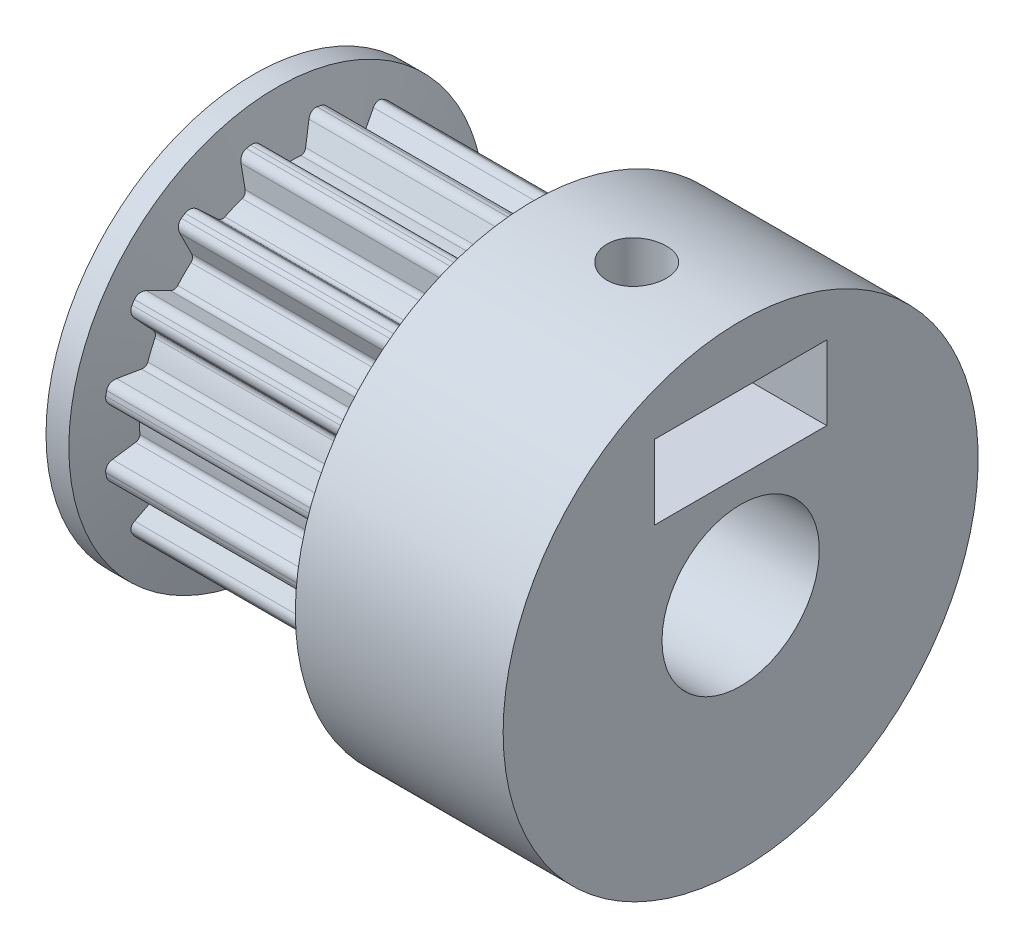
from build123d import *

# Parameters (mm, degrees)
SKETCH2_W          = 9
SKETCH2_H          = 6.1
COG_DEPTH          = 13.466755793
PATTERN_COG_COUNT  = 16
SKETCH3_W          = 7
SKETCH3_H          = 8
SKETCH8_W          = 16
SKETCH8_H          = 2.65
SKETCH15_W         = 1
SKETCH15_H         = 197.35
CUT_EXTRUDE1_DEPTH = 2.5


with BuildPart() as part:
    # Sketch2 → Body (revolve)
    with BuildSketch(Plane.XY, mode=Mode.PRIVATE) as body_sk:
        with Locations((4.5, 3.05)):
            Rectangle(SKETCH2_W, SKETCH2_H)
    revolve(body_sk.sketch.rotate(Axis((0, 0, 0), (1, 0, 0)), 90), axis=Axis((0, 0, 0), (1, 0, 0)))

    # Sketch6 → Cog (cut, through all)
    with BuildSketch(Plane(origin=(0, 0, 0), x_dir=(0, 0, -1), z_dir=(1, 0, 0))):
        with BuildLine():
            Line((0.789835397, 5.82877936), (0.508392514, 5.225223151))
            ThreePointArc((0.508392514, 5.225223151), (0.429351309, 5.137842761), (0.314832372, 5.1101253))
            ThreePointArc((0.314832372, 5.1101253), (0, 5.11981445), (-0.314832372, 5.1101253))
            ThreePointArc((-0.314832372, 5.1101253), (-0.429351309, 5.137842761), (-0.508392514, 5.225223151))
            Line((-0.508392514, 5.225223151), (-0.789835397, 5.82877936))
            ThreePointArc((-0.789835397, 5.82877936), (-0.924476923, 5.968756351), (-1.116644684, 5.996924599))
            ThreePointArc((-1.116644684, 5.996924599), (0, 6.1), (1.116644684, 5.996924599))
            ThreePointArc((1.116644684, 5.996924599), (0.924476923, 5.968756351), (0.789835397, 5.82877936))
        make_face()
    cog = extrude(amount=COG_DEPTH, mode=Mode.SUBTRACT)

    # Pattern-Cog: Cog ×16 about axis
    pattern_cog_axis = Axis((0, 0, 0), (1, 0, 0))
    for i in range(1, PATTERN_COG_COUNT):
        add(cog.rotate(pattern_cog_axis, i * 360 / PATTERN_COG_COUNT), mode=Mode.SUBTRACT)

    # Sketch3 → Hub (revolve)
    with BuildSketch(Plane.XY, mode=Mode.PRIVATE) as hub_sk:
        with Locations((12.5, 4)):
            Rectangle(SKETCH3_W, SKETCH3_H)
    revolve(hub_sk.sketch.rotate(Axis((0, 0, 0), (1, 0, 0)), 90), axis=Axis((0, 0, 0), (1, 0, 0)))

    # Sketch8 → Hole-Shaft (revolve, cut)
    with BuildSketch(Plane.XY, mode=Mode.PRIVATE) as hole_shaft_sk:
        with Locations((8, -1.325)):
            Rectangle(SKETCH8_W, SKETCH8_H)
    revolve(hole_shaft_sk.sketch.rotate(Axis((0, 0, 0), (1, 0, 0)), 270), axis=Axis((0, 0, 0), (1, 0, 0)), mode=Mode.SUBTRACT)

    # Sketch15 → Stop-Screw (revolve, cut)
    with BuildSketch(Plane.XY, mode=Mode.PRIVATE) as stop_screw_sk:
        with Locations((13, 98.675)):
            Rectangle(SKETCH15_W, SKETCH15_H)
    revolve(stop_screw_sk.sketch.rotate(Axis((12.5, 197.35, 0), (0, -1, 0)), 90), axis=Axis((12.5, 197.35, 0), (0, -1, 0)), mode=Mode.SUBTRACT)

    # Sketch16 → Flange-Left (revolve)
    with BuildSketch(Plane.XY, mode=Mode.PRIVATE) as flange_left_sk:
        Polygon((0, 2.542315139), (-0.39810301, 2.542315139), (-0.39810301, 7), (0.370293839, 7), (1.10189699, 4.269619869), (1.10189699, 2.542315139), align=None)
    revolve(flange_left_sk.sketch.rotate(Axis((0, 0, 0), (1, 0, 0)), 90), axis=Axis((0, 0, 0), (1, 0, 0)))

    # Sketch18 → Cut-Extrude1 (cut)
    with BuildSketch(Plane(origin=(0, 3.5, 0), x_dir=(-1, 0, 0), z_dir=(0, 1, 0))):
        Polygon((-16.41744749, 2.9), (-16.41744749, -2.9), (-10.825684219, -2.9), (-9.151368439, 0), (-10.825684219, 2.9), align=None)
    extrude(amount=CUT_EXTRUDE1_DEPTH, mode=Mode.SUBTRACT)


solid = part.part
